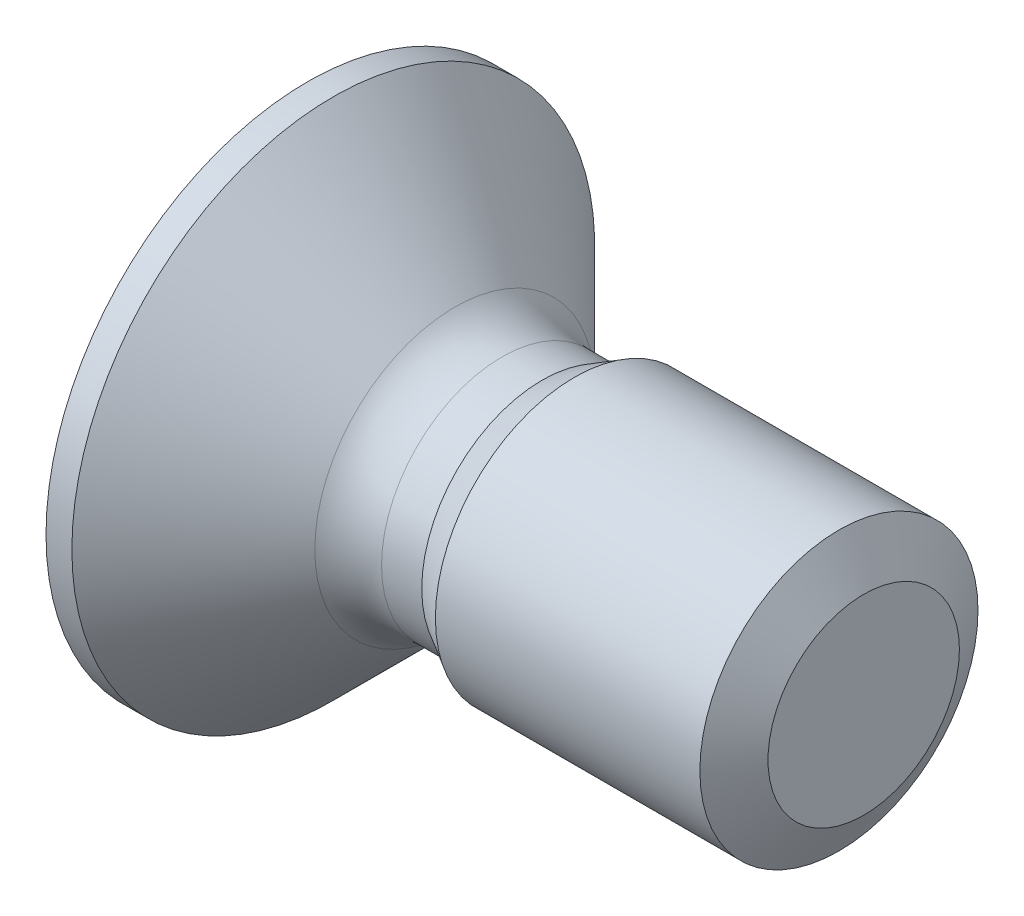
from build123d import *

# Parameters (mm, degrees)
PATTERN_CIRCULAR_1_COUNT = 2
PATTERN_CIRCULAR_1_ANGLE = 90


with BuildPart() as part:
    # 草图1 → Revolve 707 (revolve)
    with BuildSketch(Plane.XY, mode=Mode.PRIVATE) as revolve_707_sk:
        with BuildLine():
            Line((0, 0), (0, 2.35))
            Line((0, 2.35), (0.2325, 2.35))
            Line((0.2325, 2.35), (1.324264069, 1.258235931))
            ThreePointArc((1.324264069, 1.258235931), (1.518918078, 1.12817228), (1.748528137, 1.0825))
            Line((1.748528137, 1.0825), (2.10988149, 1.0825))
            Line((2.10988149, 1.0825), (2.4, 1.25))
            Line((2.4, 1.25), (5, 1.25))
            Line((5, 1.25), (5, 0))
            Line((5, 0), (0, 0))
        make_face()
    revolve(revolve_707_sk.sketch.rotate(Axis((0, 0, 0), (1, 0, 0)), 90), axis=Axis((0, 0, 0), (1, 0, 0)))

    # 草图2 → 切除-旋转1 (revolve, cut)
    with BuildSketch(Plane.XY, mode=Mode.PRIVATE) as cut_revolve_1_sk:
        Polygon((4.777437203, 1.25), (5.227437203, 1.25), (5, 0.8603), align=None)
    revolve(cut_revolve_1_sk.sketch.rotate(Axis((0, 0, 0), (-1, 0, 0)), 270), axis=Axis((0, 0, 0), (-1, 0, 0)), mode=Mode.SUBTRACT)

    # 草图3 → 切除-放样1 section 0
    with BuildSketch(Plane.ZY, mode=Mode.PRIVATE) as loft_1_s0:
        with BuildLine():
            Line((-1.45, 0.225), (1.45, 0.225))
            Line((1.45, 0.225), (1.45, -0.225))
            Line((1.45, -0.225), (-1.45, -0.225))
            Line((-1.45, -0.225), (-1.45, 0.225))
        make_face()
    loft_1 = loft([loft_1_s0.sketch, Vertex(1.8, 0, 0)], mode=Mode.SUBTRACT)

    # 阵列(圆周)1: 切除-放样1 ×2 about axis
    pattern_circular_1_axis = Axis((0, 0, 0), (1, 0, 0))
    for i in range(1, PATTERN_CIRCULAR_1_COUNT):
        add(loft_1.rotate(pattern_circular_1_axis, i * PATTERN_CIRCULAR_1_ANGLE / (PATTERN_CIRCULAR_1_COUNT - 1)), mode=Mode.SUBTRACT)


solid = part.part
